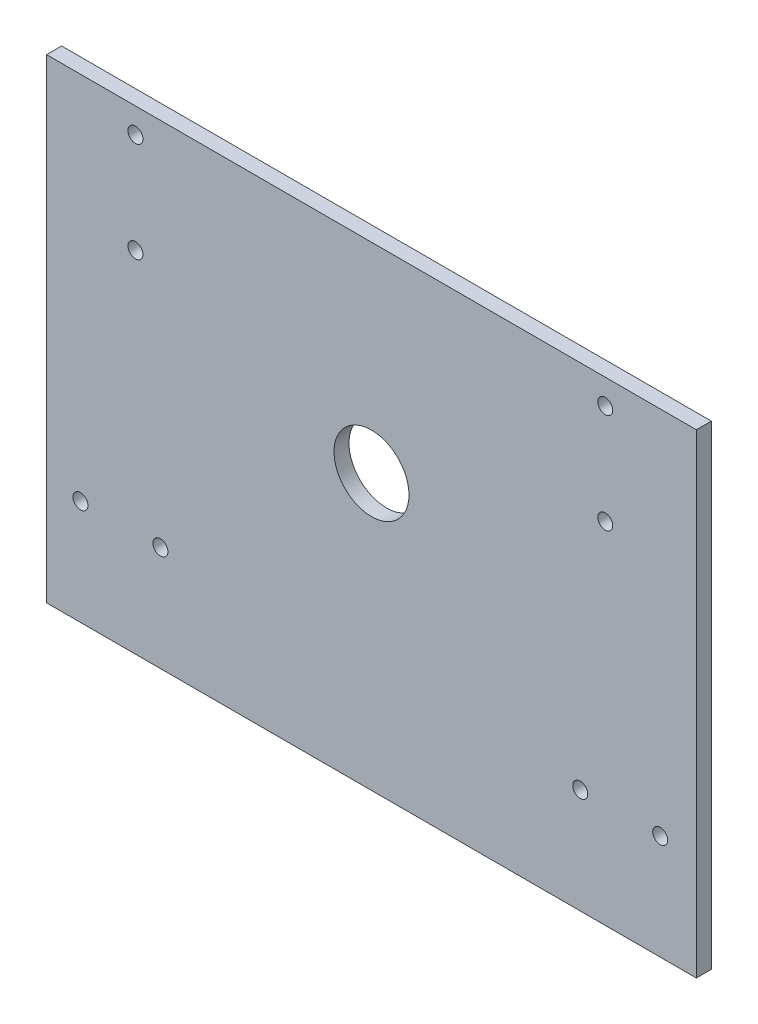
from build123d import *

# Parameters (mm, degrees)
SKETCH_1_W          = 130
SKETCH_1_H          = 95
EXTRUDE_1_DEPTH     = 3
SKETCH_3_R          = 1.5
CUT_EXTRUDE_2_DEPTH = 10
SKETCH_4_R          = 1.5
CUT_EXTRUDE_3_DEPTH = 10
SKETCH_5_R          = 7.5
CUT_EXTRUDE_4_DEPTH = 10


with BuildPart() as part:
    # 草图1 → 凸台-拉伸1 (new body)
    with BuildSketch(Plane.XY):
        Rectangle(SKETCH_1_W, SKETCH_1_H)
    extrude(amount=EXTRUDE_1_DEPTH)

    # 草图3 → 切除-拉伸2 (cut)
    with BuildSketch(Plane(origin=(0, 0, 0), x_dir=(-1, 0, 0), z_dir=(0, 0, -1))):
        with Locations((-57.767112616, -26.5)):
            Circle(SKETCH_3_R)
        with Locations((-41.767112616, -26.5)):
            Circle(SKETCH_3_R)
        with Locations((42.232887384, -26.5)):
            Circle(SKETCH_3_R)
        with Locations((58.232887384, -26.5)):
            Circle(SKETCH_3_R)
    extrude(amount=-CUT_EXTRUDE_2_DEPTH, mode=Mode.SUBTRACT)

    # 草图4 → 切除-拉伸3 (cut)
    with BuildSketch(Plane(origin=(0, 0, 0), x_dir=(-1, 0, 0), z_dir=(0, 0, -1))):
        with Locations((-46.767112616, 42.5)):
            Circle(SKETCH_4_R)
        with Locations((-46.767112616, 22.5)):
            Circle(SKETCH_4_R)
        with Locations((47.232887384, 42.5)):
            Circle(SKETCH_4_R)
        with Locations((47.232887384, 22.5)):
            Circle(SKETCH_4_R)
    extrude(amount=-CUT_EXTRUDE_3_DEPTH, mode=Mode.SUBTRACT)

    # 草图5 → 切除-拉伸4 (cut)
    with BuildSketch(Plane.XY.offset(3)):
        with Locations((0, 7.452587902)):
            Circle(SKETCH_5_R)
    extrude(amount=-CUT_EXTRUDE_4_DEPTH, mode=Mode.SUBTRACT)


solid = part.part
